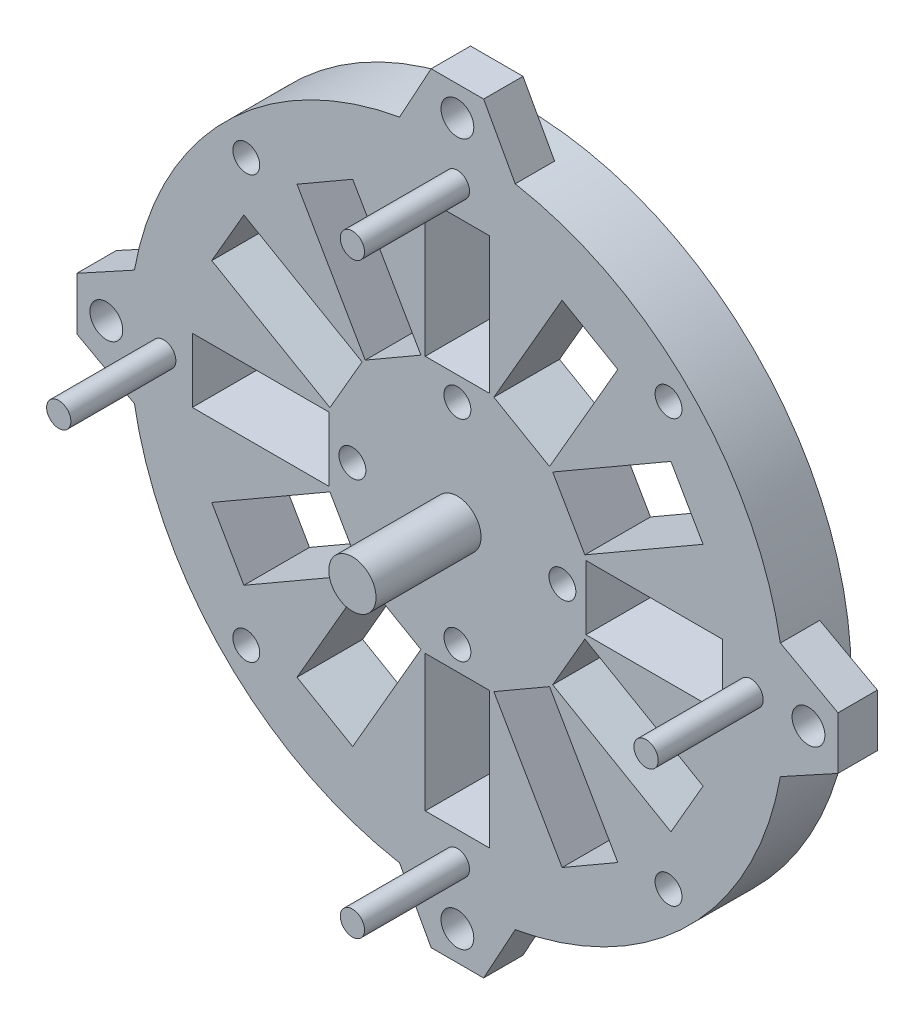
from build123d import *

# Parameters (mm, degrees)
CROQUIS2_R              = 50
SALIENTE_EXTRUIR1_DEPTH = 10
CROQUIS1_W              = 9.8
CROQUIS1_H              = 20.8
CROQUIS1_W_2            = 20.8
CROQUIS1_H_2            = 9.8
CORTAR_EXTRUIR3_DEPTH   = 72.414284285
CROQUIS4_R              = 3.6
SALIENTE_EXTRUIR2_DEPTH = 16
CROQUIS5_R              = 1.85
SALIENTE_EXTRUIR3_DEPTH = 16
SALIENTE_EXTRUIR4_START = -6
SALIENTE_EXTRUIR4_DEPTH = 6
CROQUIS8_R              = 2.5
CORTAR_EXTRUIR4_DEPTH   = 6.5
CROQUIS9_R              = 2.05
CORTAR_EXTRUIR5_DEPTH   = 6


with BuildPart() as part:
    # Croquis2 → Saliente-Extruir1 (new body)
    with BuildSketch(Plane(origin=(0, 0, 0), x_dir=(0, 1, 0), z_dir=(0, 0, 1))):
        with Locations(Location((0, 0, 0), (0, 0, 270))):
            Circle(CROQUIS2_R)
    extrude(amount=SALIENTE_EXTRUIR1_DEPTH)

    # Croquis1 → Cortar-Extruir3 (cut, through all)
    with BuildSketch(Plane(origin=(0, 0, 0), x_dir=(0, 1, 0), z_dir=(0, 0, 1))):
        Polygon((15.956475521, 37.437426313), (5.556475521, 19.424097914), (14.043524479, 14.524097914), (24.443524479, 32.537426313), align=None)
        with Locations((0, 30)):
            Rectangle(CROQUIS1_W, CROQUIS1_H)
        Polygon((32.537426313, 24.443524479), (14.524097914, 14.043524479), (19.424097914, 5.556475521), (37.437426313, 15.956475521), align=None)
        with Locations((30, 0)):
            Rectangle(CROQUIS1_W_2, CROQUIS1_H_2)
        Polygon((37.437426313, -15.956475521), (19.424097914, -5.556475521), (14.524097914, -14.043524479), (32.537426313, -24.443524479), align=None)
        Polygon((24.443524479, -32.537426313), (14.043524479, -14.524097914), (5.556475521, -19.424097914), (15.956475521, -37.437426313), align=None)
        with Locations((0, -30)):
            Rectangle(CROQUIS1_W, CROQUIS1_H)
        Polygon((-15.956475521, -37.437426313), (-5.556475521, -19.424097914), (-14.043524479, -14.524097914), (-24.443524479, -32.537426313), align=None)
        Polygon((-32.537426313, -24.443524479), (-14.524097914, -14.043524479), (-19.424097914, -5.556475521), (-37.437426313, -15.956475521), align=None)
        with Locations((-30, 0)):
            Rectangle(CROQUIS1_W_2, CROQUIS1_H_2)
        Polygon((-37.437426313, 15.956475521), (-19.424097914, 5.556475521), (-14.524097914, 14.043524479), (-32.537426313, 24.443524479), align=None)
        Polygon((-24.443524479, 32.537426313), (-14.043524479, 14.524097914), (-5.556475521, 19.424097914), (-15.956475521, 37.437426313), align=None)
    extrude(amount=CORTAR_EXTRUIR3_DEPTH, mode=Mode.SUBTRACT)

    # Croquis4 → Saliente-Extruir2 (add)
    with BuildSketch(Plane.XY.offset(10)):
        Circle(CROQUIS4_R)
    extrude(amount=SALIENTE_EXTRUIR2_DEPTH)

    # Croquis5 → Saliente-Extruir3 (add)
    with BuildSketch(Plane.XY.offset(10)):
        with Locations((0, 44.75)):
            Circle(CROQUIS5_R)
        with Locations((44.75, 0)):
            Circle(CROQUIS5_R)
        with Locations((0, -44.75)):
            Circle(CROQUIS5_R)
        with Locations((-44.75, 0)):
            Circle(CROQUIS5_R)
    extrude(amount=SALIENTE_EXTRUIR3_DEPTH)

    # Croquis7 → Saliente-Extruir4 (add)
    with BuildSketch(Plane.XY.offset(10).offset(SALIENTE_EXTRUIR4_START)):
        with BuildLine():
            Line((4, 58), (8.81247625, 49.217276056))
            ThreePointArc((8.81247625, 49.217276056), (0, 50), (-8.81247625, 49.217276056))
            Line((-8.81247625, 49.217276056), (-4, 58))
            Line((-4, 58), (4, 58))
        make_face()
        with BuildLine():
            Line((58, 4), (49.217276056, 8.81247625))
            ThreePointArc((49.217276056, 8.81247625), (50, 0), (49.217276056, -8.81247625))
            Line((49.217276056, -8.81247625), (58, -4))
            Line((58, -4), (58, 4))
        make_face()
        with BuildLine():
            Line((4, -58), (8.81247625, -49.217276056))
            ThreePointArc((8.81247625, -49.217276056), (0, -50), (-8.81247625, -49.217276056))
            Line((-8.81247625, -49.217276056), (-4, -58))
            Line((-4, -58), (4, -58))
        make_face()
        with BuildLine():
            Line((-58, -4), (-49.217276056, -8.81247625))
            ThreePointArc((-49.217276056, -8.81247625), (-50, 0), (-49.217276056, 8.81247625))
            Line((-49.217276056, 8.81247625), (-58, 4))
            Line((-58, 4), (-58, -4))
        make_face()
    extrude(amount=SALIENTE_EXTRUIR4_DEPTH)

    # Croquis8 → Cortar-Extruir4 (cut)
    with BuildSketch(Plane.XY.offset(10)):
        with Locations((0, 53.5)):
            Circle(CROQUIS8_R)
        with Locations((53.5, 0)):
            Circle(CROQUIS8_R)
        with Locations((0, -53.5)):
            Circle(CROQUIS8_R)
        with Locations((-53.5, 0)):
            Circle(CROQUIS8_R)
    extrude(amount=-CORTAR_EXTRUIR4_DEPTH, mode=Mode.SUBTRACT)

    # Croquis9 → Cortar-Extruir5 (cut)
    with BuildSketch(Plane.XY.offset(10)):
        with Locations((0, 16)):
            Circle(CROQUIS9_R)
        with Locations((16, 0)):
            Circle(CROQUIS9_R)
        with Locations((0, -16)):
            Circle(CROQUIS9_R)
        with Locations((-16, 0)):
            Circle(CROQUIS9_R)
        with Locations((-32.173358544, 32.173358544)):
            Circle(CROQUIS9_R)
        with Locations((32.173358544, 32.173358544)):
            Circle(CROQUIS9_R)
        with Locations((32.173358544, -32.173358544)):
            Circle(CROQUIS9_R)
        with Locations((-32.173358544, -32.173358544)):
            Circle(CROQUIS9_R)
    extrude(amount=-CORTAR_EXTRUIR5_DEPTH, mode=Mode.SUBTRACT)


solid = part.part
